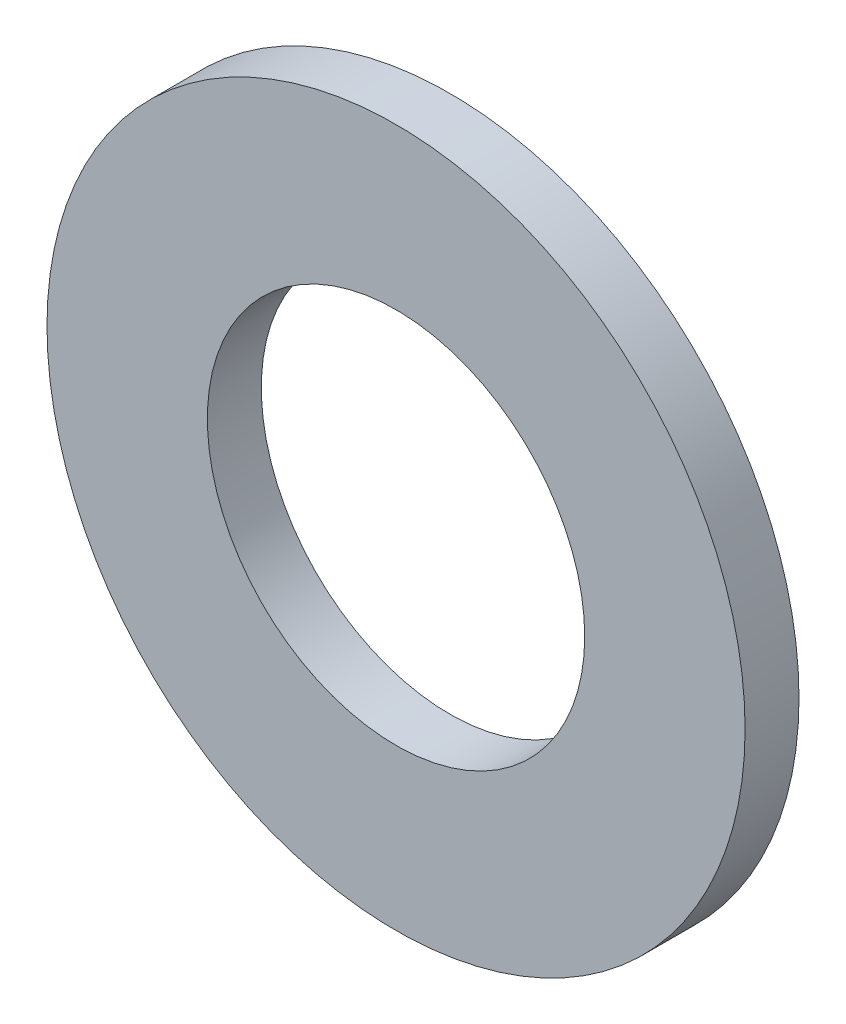
from build123d import *

# Parameters (mm, degrees)
SKETCH1_R           = 12.95
SKETCH1_R_2         = 7
BOSS_EXTRUDE1_DEPTH = 2


with BuildPart() as part:
    # Sketch1 → Boss-Extrude1 (new body)
    with BuildSketch(Plane.XY):
        Circle(SKETCH1_R)
        Circle(SKETCH1_R_2, mode=Mode.SUBTRACT)
    extrude(amount=BOSS_EXTRUDE1_DEPTH)


solid = part.part
